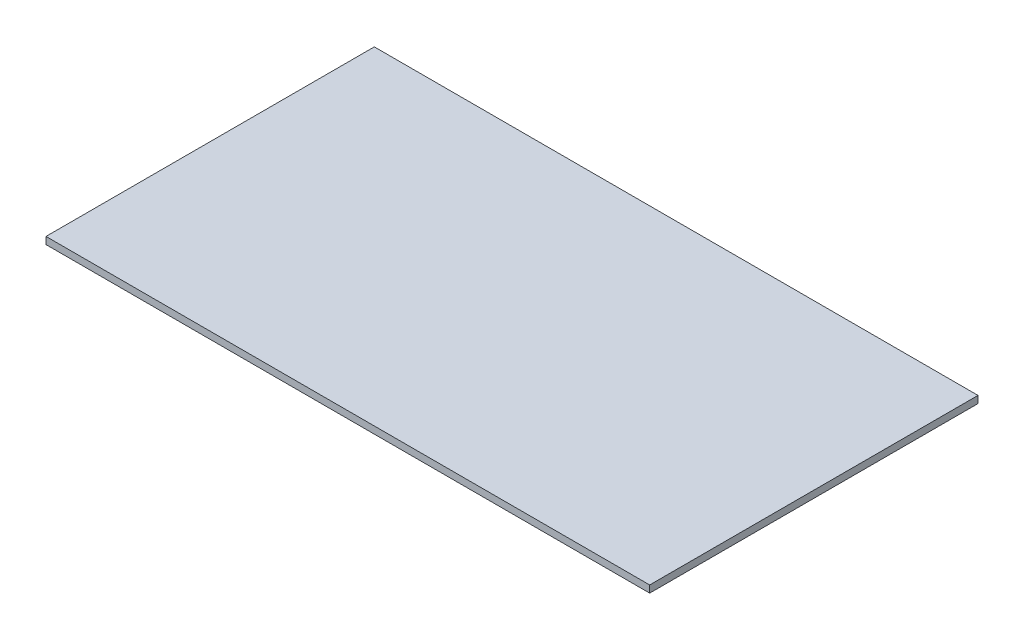
from build123d import *

# Parameters (mm, degrees)
SKETCH1_W           = 570
SKETCH1_H           = 310
BOSS_EXTRUDE1_DEPTH = 6.7


with BuildPart() as part:
    # Sketch1 → Boss-Extrude1 (new body)
    with BuildSketch(Plane(origin=(0, 0, 0), x_dir=(1, 0, 0), z_dir=(0, 1, 0))):
        Rectangle(SKETCH1_W, SKETCH1_H)
    extrude(amount=BOSS_EXTRUDE1_DEPTH)


solid = part.part
